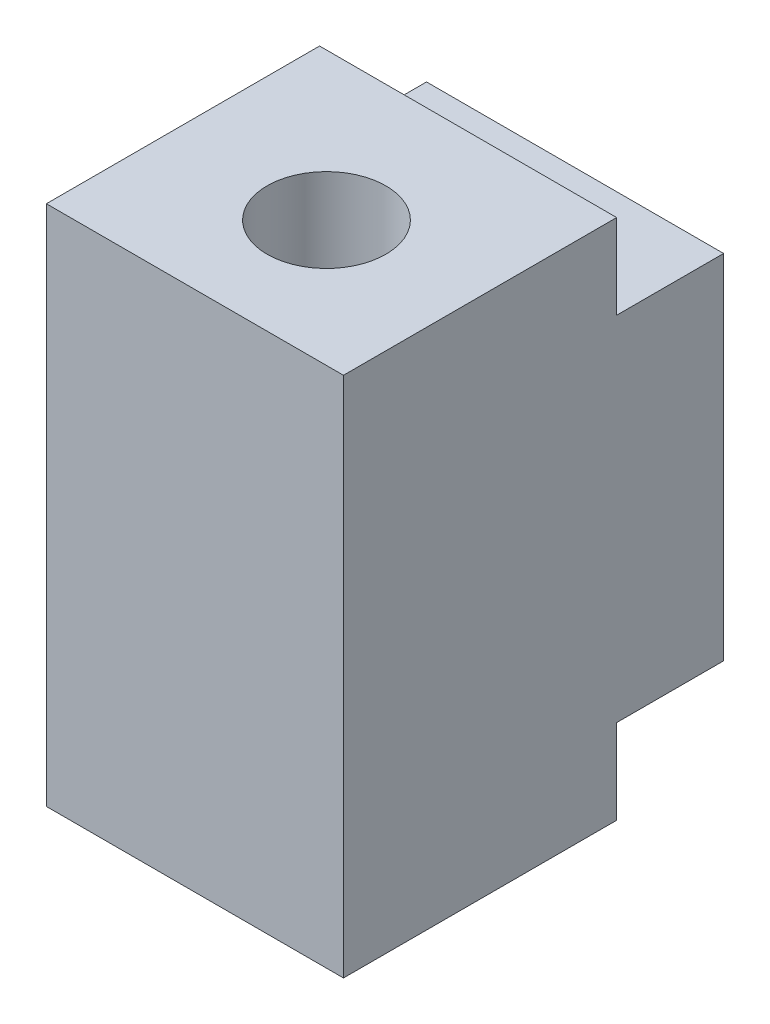
from build123d import *

# Parameters (mm, degrees)
SKETCH1_W           = 23.905693463
SKETCH1_H           = 28.387398435
BOSS_EXTRUDE1_DEPTH = 30
SKETCH3_W           = 21.980836904
SKETCH3_H           = 42
BOSS_EXTRUDE2_DEPTH = 23.905693
SKETCH2_R           = 4.775946378
CUT_EXTRUDE1_DEPTH  = 54.417670701


with BuildPart() as part:
    # Sketch1 → Boss-Extrude1 (new body)
    with BuildSketch(Plane.XY):
        with Locations((-0.452846732, 0.006300783)):
            Rectangle(SKETCH1_W, SKETCH1_H)
    extrude(amount=BOSS_EXTRUDE1_DEPTH)

    # Sketch3 → Boss-Extrude2 (add, through all)
    with BuildSketch(Plane(origin=(11.5, 0, 0), x_dir=(0, 0, -1), z_dir=(1, 0, 0))):
        with Locations((-19.596283116, 0.006300783)):
            Rectangle(SKETCH3_W, SKETCH3_H)
    extrude(amount=-BOSS_EXTRUDE2_DEPTH)

    # Sketch2 → Cut-Extrude1 (cut, through all)
    with BuildSketch(Plane(origin=(0, 21.006300783, 0), x_dir=(1, 0, 0), z_dir=(0, 1, 0))):
        with Locations(Location((0, -20.454249212, 0), (0, 0, 270))):
            Circle(SKETCH2_R)
    extrude(amount=-CUT_EXTRUDE1_DEPTH, mode=Mode.SUBTRACT)


solid = part.part
